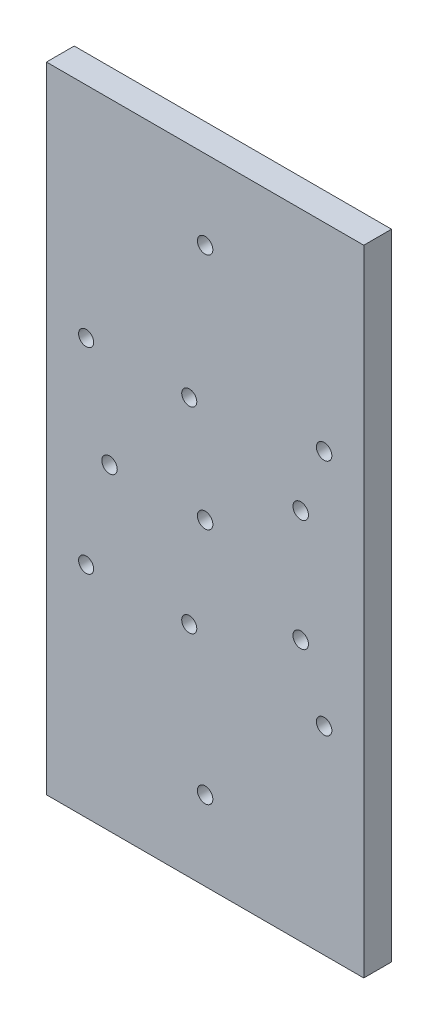
from build123d import *

# Parameters (mm, degrees)
EXTRUDE_1_DEPTH     = 7
CUT_EXTRUDE_2_DEPTH = 10
CUT_EXTRUDE_1_DEPTH = 10


with BuildPart() as part:
    # 草图1 → 凸台-拉伸1 (new body)
    with BuildSketch(Plane.XY):
        with BuildLine():
            Line((0, 61.95), (0, 80))
            Line((0, 80), (-40, 80))
            Line((-40, 80), (-40, -80))
            Line((-40, -80), (0, -80))
            Line((0, -80), (0, -61.95))
            ThreePointArc((0, -61.95), (-1.95, -60), (0, -58.05))
            Line((0, -58.05), (0, -1.95))
            ThreePointArc((0, -1.95), (-1.95, 0), (0, 1.95))
            Line((0, 1.95), (0, 58.05))
            ThreePointArc((0, 58.05), (-1.95, 60), (0, 61.95))
        make_face()
        with BuildLine():
            Line((30, 80), (0, 80))
            Line((0, 80), (0, 61.95))
            ThreePointArc((0, 61.95), (1.378858223, 61.378858223), (1.95, 60))
            ThreePointArc((1.95, 60), (1.378858223, 58.621141777), (0, 58.05))
            Line((0, 58.05), (0, 1.95))
            ThreePointArc((0, 1.95), (1.378858223, 1.378858223), (1.95, 0))
            ThreePointArc((1.95, 0), (1.378858223, -1.378858223), (0, -1.95))
            Line((0, -1.95), (0, -58.05))
            ThreePointArc((0, -58.05), (1.378858223, -58.621141777), (1.95, -60))
            ThreePointArc((1.95, -60), (1.378858223, -61.378858223), (0, -61.95))
            Line((0, -61.95), (0, -80))
            Line((0, -80), (30, -80))
            Line((30, -80), (30, -31.95))
            ThreePointArc((30, -31.95), (28.05, -30), (30, -28.05))
            Line((30, -28.05), (30, 28.05))
            ThreePointArc((30, 28.05), (28.05, 30), (30, 31.95))
            Line((30, 31.95), (30, 80))
        make_face()
        with BuildLine():
            Line((40, 80), (30, 80))
            Line((30, 80), (30, 31.95))
            ThreePointArc((30, 31.95), (31.378858223, 31.378858223), (31.95, 30))
            ThreePointArc((31.95, 30), (31.378858223, 28.621141777), (30, 28.05))
            Line((30, 28.05), (30, -28.05))
            ThreePointArc((30, -28.05), (31.378858223, -28.621141777), (31.95, -30))
            ThreePointArc((31.95, -30), (31.378858223, -31.378858223), (30, -31.95))
            Line((30, -31.95), (30, -80))
            Line((30, -80), (40, -80))
            Line((40, -80), (40, 80))
        make_face()
    extrude(amount=EXTRUDE_1_DEPTH)

    # 草图3 → 切除-拉伸2 (cut)
    with BuildSketch(Plane.XY.offset(7)):
        with BuildLine():
            ThreePointArc((-28.1, 24.75), (-31.343502884, 26.093502884), (-30, 22.85))
            Line((-30, 22.85), (-30, 24.75))
            Line((-30, 24.75), (-28.1, 24.75))
        make_face()
        with BuildLine():
            Line((-30, 24.75), (-30, 22.85))
            ThreePointArc((-30, 22.85), (-28.656497116, 23.406497116), (-28.1, 24.75))
            Line((-28.1, 24.75), (-30, 24.75))
        make_face()
        with BuildLine():
            ThreePointArc((-5.9, 24.75), (-5.343502884, 23.406497116), (-4, 22.85))
            Line((-4, 22.85), (-4, 24.75))
            Line((-4, 24.75), (-5.9, 24.75))
        make_face()
        with BuildLine():
            Line((-4, 24.75), (-4, 22.85))
            ThreePointArc((-4, 22.85), (-2.656497116, 23.406497116), (-2.1, 24.75))
            ThreePointArc((-2.1, 24.75), (-4, 26.65), (-5.9, 24.75))
            Line((-5.9, 24.75), (-4, 24.75))
        make_face()
        with BuildLine():
            Line((-30, -22.85), (-30, -24.75))
            Line((-30, -24.75), (-28.1, -24.75))
            ThreePointArc((-28.1, -24.75), (-28.656497116, -23.406497116), (-30, -22.85))
        make_face()
        with BuildLine():
            Line((-28.1, -24.75), (-30, -24.75))
            Line((-30, -24.75), (-30, -22.85))
            ThreePointArc((-30, -22.85), (-31.343502884, -26.093502884), (-28.1, -24.75))
        make_face()
        with BuildLine():
            ThreePointArc((-4, -22.85), (-5.343502884, -23.406497116), (-5.9, -24.75))
            Line((-5.9, -24.75), (-4, -24.75))
            Line((-4, -24.75), (-4, -22.85))
        make_face()
        with BuildLine():
            Line((-4, -24.75), (-5.9, -24.75))
            ThreePointArc((-5.9, -24.75), (-4, -26.65), (-2.1, -24.75))
            ThreePointArc((-2.1, -24.75), (-2.656497116, -23.406497116), (-4, -22.85))
            Line((-4, -22.85), (-4, -24.75))
        make_face()
    extrude(amount=-CUT_EXTRUDE_2_DEPTH, mode=Mode.SUBTRACT)

    # 草图2 → 切除-拉伸1 (cut)
    with BuildSketch(Plane.XY.offset(7)):
        with BuildLine():
            ThreePointArc((-24.1, 1.95), (-26.05, 0), (-24.1, -1.95))
            Line((-24.1, -1.95), (-24.1, 1.95))
        make_face()
        with BuildLine():
            Line((-24.1, 1.95), (-24.1, -1.95))
            ThreePointArc((-24.1, -1.95), (-22.721141777, -1.378858223), (-22.15, 0))
            ThreePointArc((-22.15, 0), (-22.721141777, 1.378858223), (-24.1, 1.95))
        make_face()
        with BuildLine():
            ThreePointArc((24.1, -12.15), (22.721141777, -12.721141777), (22.15, -14.1))
            Line((22.15, -14.1), (24.1, -14.1))
            Line((24.1, -14.1), (24.1, -12.15))
        make_face()
        with BuildLine():
            Line((24.1, -14.1), (22.15, -14.1))
            ThreePointArc((22.15, -14.1), (24.1, -16.05), (26.05, -14.1))
            ThreePointArc((26.05, -14.1), (25.478858223, -12.721141777), (24.1, -12.15))
            Line((24.1, -12.15), (24.1, -14.1))
        make_face()
        with BuildLine():
            ThreePointArc((22.15, 14.1), (22.721141777, 12.721141777), (24.1, 12.15))
            Line((24.1, 12.15), (24.1, 14.1))
            Line((24.1, 14.1), (22.15, 14.1))
        make_face()
        with BuildLine():
            Line((24.1, 14.1), (24.1, 12.15))
            ThreePointArc((24.1, 12.15), (25.478858223, 12.721141777), (26.05, 14.1))
            ThreePointArc((26.05, 14.1), (24.1, 16.05), (22.15, 14.1))
            Line((22.15, 14.1), (24.1, 14.1))
        make_face()
    extrude(amount=-CUT_EXTRUDE_1_DEPTH, mode=Mode.SUBTRACT)


solid = part.part
